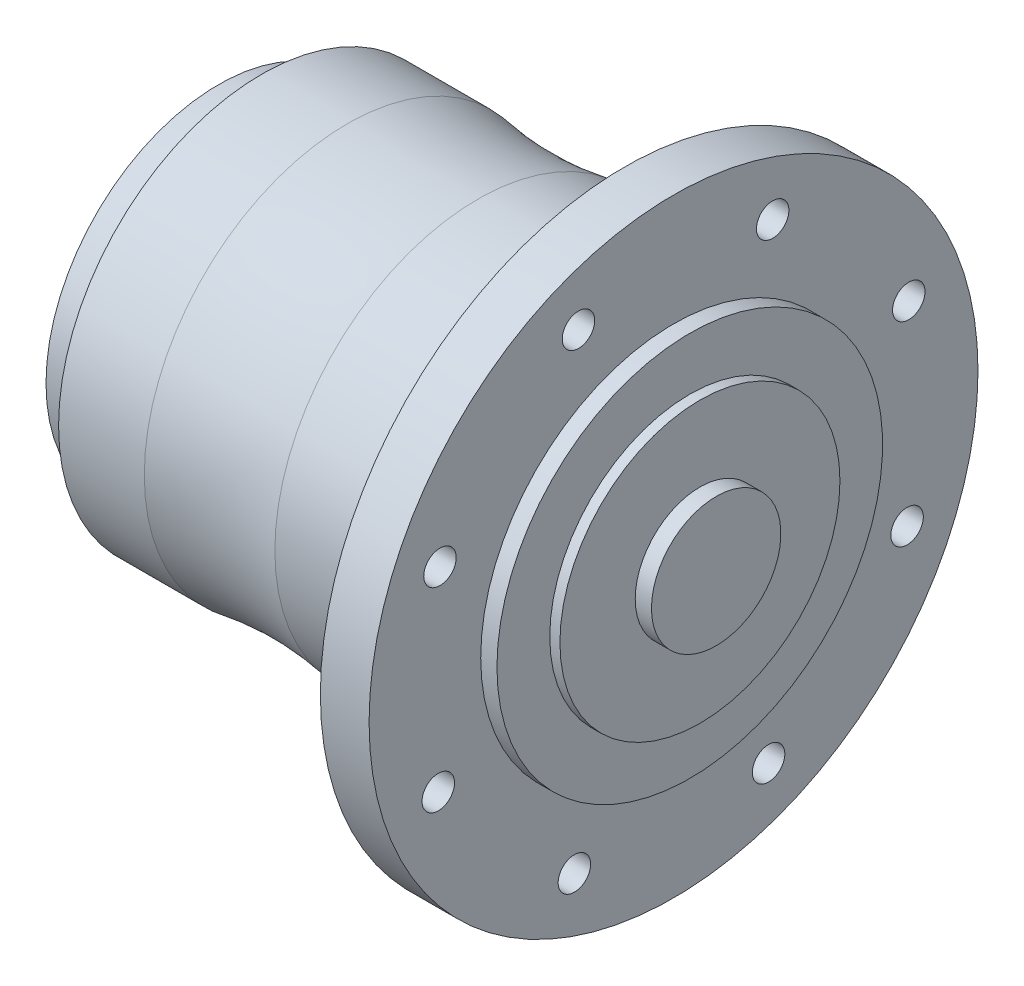
from build123d import *

# Parameters (mm, degrees)
KES_EKSTR_ZYON1_REACH   = 304.391
DAIRESEL_O_ALTMA1_COUNT = 8


with BuildPart() as part:
    # Çizim1 → Döndür1 (revolve)
    with BuildSketch(Plane.XY, mode=Mode.PRIVATE) as d_nd_r1_sk:
        with BuildLine():
            Line((0, 0), (0, 40))
            Line((0, 40), (8, 40))
            Line((8, 40), (8, 55))
            Line((8, 55), (15.334183147, 55))
            Line((15.334183147, 55), (15.334183147, 85))
            Line((15.334183147, 85), (36.525030294, 85))
            Line((36.525030294, 85), (36.525030294, 100))
            Line((36.525030294, 100), (78.752599468, 100))
            ThreePointArc((78.752599468, 100), (110.917946702, 97.381418717), (143.083293936, 100))
            Line((143.083293936, 100), (215.5, 100))
            Line((215.5, 100), (215.5, 150))
            Line((215.5, 150), (239.5, 150))
            Line((239.5, 150), (239.5, 95))
            Line((239.5, 95), (247.5, 95))
            Line((247.5, 95), (247.5, 68.984669624))
            Line((247.5, 68.984669624), (252.5, 68.984669624))
            Line((252.5, 68.984669624), (252.5, 31.869785878))
            Line((252.5, 31.869785878), (260.5, 31.869785878))
            Line((260.5, 31.869785878), (260.5, 0))
            Line((260.5, 0), (0, 0))
        make_face()
    revolve(d_nd_r1_sk.sketch.rotate(Axis((0, 0, 0), (1, 0, 0)), 90), axis=Axis((0, 0, 0), (1, 0, 0)))

    # Çizim2 → Kes-Ekstrüzyon1 (cut, up to next)
    with BuildSketch(Plane.ZY.offset(-215.5), mode=Mode.PRIVATE) as kes_ekstr_zyon1_sk1:
        with BuildLine():
            ThreePointArc((39.31625277, 118.65594072), (39.512748237, 112.65469332), (43.82897143, 108.480510984))
            Line((43.82897143, 108.480510984), (46.825824177, 115.897981821))
            ThreePointArc((46.825824177, 115.897981821), (43.093107796, 117.337053229), (39.31625277, 118.65594072))
        make_face()
    kes_ekstr_zyon1_tool1 = extrude(kes_ekstr_zyon1_sk1.sketch, amount=-KES_EKSTR_ZYON1_REACH, mode=Mode.PRIVATE) & part.part
    # Çizim2 → Kes-Ekstrüzyon1 (cut, up to next)
    with BuildSketch(Plane.ZY.offset(-215.5), mode=Mode.PRIVATE) as kes_ekstr_zyon1_sk2:
        with BuildLine():
            Line((46.825824177, 115.897981821), (43.82897143, 108.480510984))
            ThreePointArc((43.82897143, 108.480510984), (49.833433259, 108.484865903), (54.143597008, 112.665304788))
            ThreePointArc((54.143597008, 112.665304788), (50.510578633, 114.340200482), (46.825824177, 115.897981821))
        make_face()
    kes_ekstr_zyon1_tool2 = extrude(kes_ekstr_zyon1_sk2.sketch, amount=-KES_EKSTR_ZYON1_REACH, mode=Mode.PRIVATE) & part.part
    # Çizim2 → Kes-Ekstrüzyon1 (cut, up to next)
    with BuildSketch(Plane.ZY.offset(-215.5), mode=Mode.PRIVATE) as kes_ekstr_zyon1_sk3:
        with BuildLine():
            ThreePointArc((49.822676924, 123.315452657), (43.582535676, 123.211057761), (39.31625277, 118.65594072))
            ThreePointArc((39.31625277, 118.65594072), (43.093107796, 117.337053229), (46.825824177, 115.897981821))
            Line((46.825824177, 115.897981821), (49.822676924, 123.315452657))
        make_face()
    kes_ekstr_zyon1_tool3 = extrude(kes_ekstr_zyon1_sk3.sketch, amount=-KES_EKSTR_ZYON1_REACH, mode=Mode.PRIVATE) & part.part
    # Çizim2 → Kes-Ekstrüzyon1 (cut, up to next)
    with BuildSketch(Plane.ZY.offset(-215.5), mode=Mode.PRIVATE) as kes_ekstr_zyon1_sk4:
        with BuildLine():
            Line((49.822676924, 123.315452657), (46.825824177, 115.897981821))
            ThreePointArc((46.825824177, 115.897981821), (50.510578633, 114.340200482), (54.143597008, 112.665304788))
            ThreePointArc((54.143597008, 112.665304788), (54.653409457, 114.246040939), (54.825824177, 115.897981821))
            ThreePointArc((54.825824177, 115.897981821), (53.458124757, 120.371525049), (49.822676924, 123.315452657))
        make_face()
    kes_ekstr_zyon1_tool4 = extrude(kes_ekstr_zyon1_sk4.sketch, amount=-KES_EKSTR_ZYON1_REACH, mode=Mode.PRIVATE) & part.part
    # Çizim2 → Kes-Ekstrüzyon1 (cut, up to next)
    with BuildSketch(Plane.ZY.offset(-215.5), mode=Mode.PRIVATE) as kes_ekstr_zyon1_sk5:
        with BuildLine():
            ThreePointArc((39.31625277, 118.65594072), (39.512748237, 112.65469332), (43.82897143, 108.480510984))
            Line((43.82897143, 108.480510984), (46.825824177, 115.897981821))
            ThreePointArc((46.825824177, 115.897981821), (43.093107796, 117.337053229), (39.31625277, 118.65594072))
        make_face()
    kes_ekstr_zyon1_tool5 = extrude(kes_ekstr_zyon1_sk5.sketch, amount=-KES_EKSTR_ZYON1_REACH, mode=Mode.PRIVATE) & part.part
    # Çizim2 → Kes-Ekstrüzyon1 (cut, up to next)
    with BuildSketch(Plane.ZY.offset(-215.5), mode=Mode.PRIVATE) as kes_ekstr_zyon1_sk6:
        with BuildLine():
            Line((46.825824177, 115.897981821), (43.82897143, 108.480510984))
            ThreePointArc((43.82897143, 108.480510984), (49.833433259, 108.484865903), (54.143597008, 112.665304788))
            ThreePointArc((54.143597008, 112.665304788), (50.510578633, 114.340200482), (46.825824177, 115.897981821))
        make_face()
    kes_ekstr_zyon1_tool6 = extrude(kes_ekstr_zyon1_sk6.sketch, amount=-KES_EKSTR_ZYON1_REACH, mode=Mode.PRIVATE) & part.part
    # Çizim2 → Kes-Ekstrüzyon1 (cut, up to next)
    with BuildSketch(Plane.ZY.offset(-215.5), mode=Mode.PRIVATE) as kes_ekstr_zyon1_sk7:
        with BuildLine():
            ThreePointArc((49.822676924, 123.315452657), (43.582535676, 123.211057761), (39.31625277, 118.65594072))
            ThreePointArc((39.31625277, 118.65594072), (43.093107796, 117.337053229), (46.825824177, 115.897981821))
            Line((46.825824177, 115.897981821), (49.822676924, 123.315452657))
        make_face()
    kes_ekstr_zyon1_tool7 = extrude(kes_ekstr_zyon1_sk7.sketch, amount=-KES_EKSTR_ZYON1_REACH, mode=Mode.PRIVATE) & part.part
    # Çizim2 → Kes-Ekstrüzyon1 (cut, up to next)
    with BuildSketch(Plane.ZY.offset(-215.5), mode=Mode.PRIVATE) as kes_ekstr_zyon1_sk8:
        with BuildLine():
            Line((49.822676924, 123.315452657), (46.825824177, 115.897981821))
            ThreePointArc((46.825824177, 115.897981821), (50.510578633, 114.340200482), (54.143597008, 112.665304788))
            ThreePointArc((54.143597008, 112.665304788), (54.653409457, 114.246040939), (54.825824177, 115.897981821))
            ThreePointArc((54.825824177, 115.897981821), (53.458124757, 120.371525049), (49.822676924, 123.315452657))
        make_face()
    kes_ekstr_zyon1_tool8 = extrude(kes_ekstr_zyon1_sk8.sketch, amount=-KES_EKSTR_ZYON1_REACH, mode=Mode.PRIVATE) & part.part
    # Çizim2 → Kes-Ekstrüzyon1 (cut, up to next)
    with BuildSketch(Plane.ZY.offset(-215.5), mode=Mode.PRIVATE) as kes_ekstr_zyon1_sk9:
        with BuildLine():
            ThreePointArc((39.31625277, 118.65594072), (39.512748237, 112.65469332), (43.82897143, 108.480510984))
            Line((43.82897143, 108.480510984), (46.825824177, 115.897981821))
            ThreePointArc((46.825824177, 115.897981821), (43.093107796, 117.337053229), (39.31625277, 118.65594072))
        make_face()
    kes_ekstr_zyon1_tool9 = extrude(kes_ekstr_zyon1_sk9.sketch, amount=-KES_EKSTR_ZYON1_REACH, mode=Mode.PRIVATE) & part.part
    # Çizim2 → Kes-Ekstrüzyon1 (cut, up to next)
    with BuildSketch(Plane.ZY.offset(-215.5), mode=Mode.PRIVATE) as kes_ekstr_zyon1_sk10:
        with BuildLine():
            Line((46.825824177, 115.897981821), (43.82897143, 108.480510984))
            ThreePointArc((43.82897143, 108.480510984), (49.833433259, 108.484865903), (54.143597008, 112.665304788))
            ThreePointArc((54.143597008, 112.665304788), (50.510578633, 114.340200482), (46.825824177, 115.897981821))
        make_face()
    kes_ekstr_zyon1_tool10 = extrude(kes_ekstr_zyon1_sk10.sketch, amount=-KES_EKSTR_ZYON1_REACH, mode=Mode.PRIVATE) & part.part
    # Çizim2 → Kes-Ekstrüzyon1 (cut, up to next)
    with BuildSketch(Plane.ZY.offset(-215.5), mode=Mode.PRIVATE) as kes_ekstr_zyon1_sk11:
        with BuildLine():
            ThreePointArc((49.822676924, 123.315452657), (43.582535676, 123.211057761), (39.31625277, 118.65594072))
            ThreePointArc((39.31625277, 118.65594072), (43.093107796, 117.337053229), (46.825824177, 115.897981821))
            Line((46.825824177, 115.897981821), (49.822676924, 123.315452657))
        make_face()
    kes_ekstr_zyon1_tool11 = extrude(kes_ekstr_zyon1_sk11.sketch, amount=-KES_EKSTR_ZYON1_REACH, mode=Mode.PRIVATE) & part.part
    # Çizim2 → Kes-Ekstrüzyon1 (cut, up to next)
    with BuildSketch(Plane.ZY.offset(-215.5), mode=Mode.PRIVATE) as kes_ekstr_zyon1_sk12:
        with BuildLine():
            Line((49.822676924, 123.315452657), (46.825824177, 115.897981821))
            ThreePointArc((46.825824177, 115.897981821), (50.510578633, 114.340200482), (54.143597008, 112.665304788))
            ThreePointArc((54.143597008, 112.665304788), (54.653409457, 114.246040939), (54.825824177, 115.897981821))
            ThreePointArc((54.825824177, 115.897981821), (53.458124757, 120.371525049), (49.822676924, 123.315452657))
        make_face()
    kes_ekstr_zyon1_tool12 = extrude(kes_ekstr_zyon1_sk12.sketch, amount=-KES_EKSTR_ZYON1_REACH, mode=Mode.PRIVATE) & part.part
    # Çizim2 → Kes-Ekstrüzyon1 (cut, up to next)
    with BuildSketch(Plane.ZY.offset(-215.5), mode=Mode.PRIVATE) as kes_ekstr_zyon1_sk13:
        with BuildLine():
            ThreePointArc((39.31625277, 118.65594072), (39.512748237, 112.65469332), (43.82897143, 108.480510984))
            Line((43.82897143, 108.480510984), (46.825824177, 115.897981821))
            ThreePointArc((46.825824177, 115.897981821), (43.093107796, 117.337053229), (39.31625277, 118.65594072))
        make_face()
    kes_ekstr_zyon1_tool13 = extrude(kes_ekstr_zyon1_sk13.sketch, amount=-KES_EKSTR_ZYON1_REACH, mode=Mode.PRIVATE) & part.part
    # Çizim2 → Kes-Ekstrüzyon1 (cut, up to next)
    with BuildSketch(Plane.ZY.offset(-215.5), mode=Mode.PRIVATE) as kes_ekstr_zyon1_sk14:
        with BuildLine():
            Line((46.825824177, 115.897981821), (43.82897143, 108.480510984))
            ThreePointArc((43.82897143, 108.480510984), (49.833433259, 108.484865903), (54.143597008, 112.665304788))
            ThreePointArc((54.143597008, 112.665304788), (50.510578633, 114.340200482), (46.825824177, 115.897981821))
        make_face()
    kes_ekstr_zyon1_tool14 = extrude(kes_ekstr_zyon1_sk14.sketch, amount=-KES_EKSTR_ZYON1_REACH, mode=Mode.PRIVATE) & part.part
    # Çizim2 → Kes-Ekstrüzyon1 (cut, up to next)
    with BuildSketch(Plane.ZY.offset(-215.5), mode=Mode.PRIVATE) as kes_ekstr_zyon1_sk15:
        with BuildLine():
            ThreePointArc((49.822676924, 123.315452657), (43.582535676, 123.211057761), (39.31625277, 118.65594072))
            ThreePointArc((39.31625277, 118.65594072), (43.093107796, 117.337053229), (46.825824177, 115.897981821))
            Line((46.825824177, 115.897981821), (49.822676924, 123.315452657))
        make_face()
    kes_ekstr_zyon1_tool15 = extrude(kes_ekstr_zyon1_sk15.sketch, amount=-KES_EKSTR_ZYON1_REACH, mode=Mode.PRIVATE) & part.part
    # Çizim2 → Kes-Ekstrüzyon1 (cut, up to next)
    with BuildSketch(Plane.ZY.offset(-215.5), mode=Mode.PRIVATE) as kes_ekstr_zyon1_sk16:
        with BuildLine():
            Line((49.822676924, 123.315452657), (46.825824177, 115.897981821))
            ThreePointArc((46.825824177, 115.897981821), (50.510578633, 114.340200482), (54.143597008, 112.665304788))
            ThreePointArc((54.143597008, 112.665304788), (54.653409457, 114.246040939), (54.825824177, 115.897981821))
            ThreePointArc((54.825824177, 115.897981821), (53.458124757, 120.371525049), (49.822676924, 123.315452657))
        make_face()
    kes_ekstr_zyon1_tool16 = extrude(kes_ekstr_zyon1_sk16.sketch, amount=-KES_EKSTR_ZYON1_REACH, mode=Mode.PRIVATE) & part.part
    kes_ekstr_zyon1_1 = kes_ekstr_zyon1_tool1.solids().sort_by_distance((215.5, 113.966014, 42.421977))[0]
    add(kes_ekstr_zyon1_1, mode=Mode.SUBTRACT)
    kes_ekstr_zyon1_2 = kes_ekstr_zyon1_tool2.solids().sort_by_distance((215.5, 111.449071, 48.651629))[0]
    add(kes_ekstr_zyon1_2, mode=Mode.SUBTRACT)
    kes_ekstr_zyon1_3 = kes_ekstr_zyon1_tool3.solids().sort_by_distance((215.5, 120.28789, 44.899871))[0]
    add(kes_ekstr_zyon1_3, mode=Mode.SUBTRACT)
    kes_ekstr_zyon1_4 = kes_ekstr_zyon1_tool4.solids().sort_by_distance((215.5, 117.717938, 51.260726))[0]
    add(kes_ekstr_zyon1_4, mode=Mode.SUBTRACT)
    kes_ekstr_zyon1_5 = kes_ekstr_zyon1_tool5.solids().sort_by_distance((215.5, 113.966014, 42.421977))[0]
    add(kes_ekstr_zyon1_5, mode=Mode.SUBTRACT)
    kes_ekstr_zyon1_6 = kes_ekstr_zyon1_tool6.solids().sort_by_distance((215.5, 111.449071, 48.651629))[0]
    add(kes_ekstr_zyon1_6, mode=Mode.SUBTRACT)
    kes_ekstr_zyon1_7 = kes_ekstr_zyon1_tool7.solids().sort_by_distance((215.5, 120.28789, 44.899871))[0]
    add(kes_ekstr_zyon1_7, mode=Mode.SUBTRACT)
    kes_ekstr_zyon1_8 = kes_ekstr_zyon1_tool8.solids().sort_by_distance((215.5, 117.717938, 51.260726))[0]
    add(kes_ekstr_zyon1_8, mode=Mode.SUBTRACT)
    kes_ekstr_zyon1_9 = kes_ekstr_zyon1_tool9.solids().sort_by_distance((215.5, 113.966014, 42.421977))[0]
    add(kes_ekstr_zyon1_9, mode=Mode.SUBTRACT)
    kes_ekstr_zyon1_10 = kes_ekstr_zyon1_tool10.solids().sort_by_distance((215.5, 111.449071, 48.651629))[0]
    add(kes_ekstr_zyon1_10, mode=Mode.SUBTRACT)
    kes_ekstr_zyon1_11 = kes_ekstr_zyon1_tool11.solids().sort_by_distance((215.5, 120.28789, 44.899871))[0]
    add(kes_ekstr_zyon1_11, mode=Mode.SUBTRACT)
    kes_ekstr_zyon1_12 = kes_ekstr_zyon1_tool12.solids().sort_by_distance((215.5, 117.717938, 51.260726))[0]
    add(kes_ekstr_zyon1_12, mode=Mode.SUBTRACT)
    kes_ekstr_zyon1_13 = kes_ekstr_zyon1_tool13.solids().sort_by_distance((215.5, 113.966014, 42.421977))[0]
    add(kes_ekstr_zyon1_13, mode=Mode.SUBTRACT)
    kes_ekstr_zyon1_14 = kes_ekstr_zyon1_tool14.solids().sort_by_distance((215.5, 111.449071, 48.651629))[0]
    add(kes_ekstr_zyon1_14, mode=Mode.SUBTRACT)
    kes_ekstr_zyon1_15 = kes_ekstr_zyon1_tool15.solids().sort_by_distance((215.5, 120.28789, 44.899871))[0]
    add(kes_ekstr_zyon1_15, mode=Mode.SUBTRACT)
    kes_ekstr_zyon1_16 = kes_ekstr_zyon1_tool16.solids().sort_by_distance((215.5, 117.717938, 51.260726))[0]
    add(kes_ekstr_zyon1_16, mode=Mode.SUBTRACT)
    kes_ekstr_zyon1 = kes_ekstr_zyon1_1 + kes_ekstr_zyon1_2 + kes_ekstr_zyon1_3 + kes_ekstr_zyon1_4 + kes_ekstr_zyon1_5 + kes_ekstr_zyon1_6 + kes_ekstr_zyon1_7 + kes_ekstr_zyon1_8 + kes_ekstr_zyon1_9 + kes_ekstr_zyon1_10 + kes_ekstr_zyon1_11 + kes_ekstr_zyon1_12 + kes_ekstr_zyon1_13 + kes_ekstr_zyon1_14 + kes_ekstr_zyon1_15 + kes_ekstr_zyon1_16  # Kes-Ekstrüzyon1 as one shape, for the pattern or mirror that repeats it

    # Dairesel Çoğaltma1: Kes-Ekstrüzyon1 ×8 about axis
    dairesel_o_altma1_axis = Axis((0, 0, 0), (1, 0, 0))
    for i in range(1, DAIRESEL_O_ALTMA1_COUNT):
        add(kes_ekstr_zyon1.rotate(dairesel_o_altma1_axis, i * 360 / DAIRESEL_O_ALTMA1_COUNT), mode=Mode.SUBTRACT)


solid = part.part
